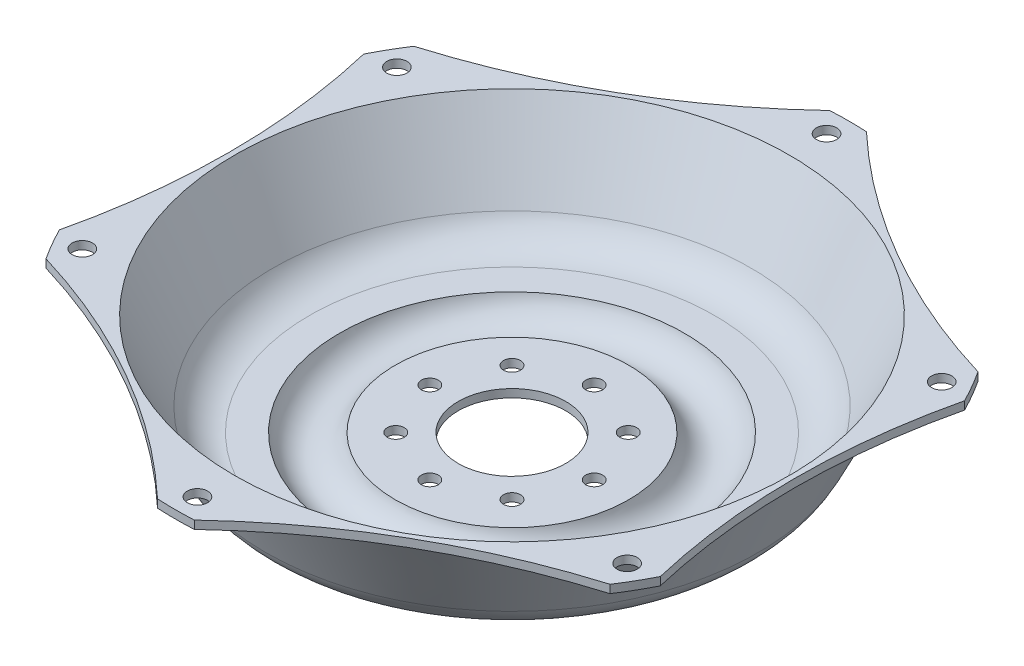
from build123d import *

# Parameters (mm, degrees)
THICKEN1_T1        = 12
CUT_EXTRUDE1_DEPTH = 727.760405867
CIRPATTERN1_COUNT  = 6
CIRPATTERN2_COUNT  = 8


with BuildPart() as body_1:
    # Surface-Revolve1: a surface, the sketch's curves turned about an axis
    with BuildLine(Plane.XY, mode=Mode.PRIVATE) as surface_revolve1_1_path:
        Line((79.5, 0), (172.5, 0))
        ThreePointArc((172.5, 0), (213.5312381, -30.75), (254.5624762, 0))
        Line((254.5624762, 0), (299.5624762, 0))
        ThreePointArc((299.5624762, 0), (331.357632054, 9.117114231), (353.490118977, 33.697731193))
        Line((353.490118977, 33.697731193), (410.214525599, 150))
        Line((410.214525599, 150), (497.75, 150))
    surface_revolve1_1 = Shell.revolve(surface_revolve1_1_path.wire(), 360, Axis((0, 0, 0), (0, 1, 0)))
    add(Solid.thicken(surface_revolve1_1, THICKEN1_T1))

    # Sketch2 → Cut-Extrude1 (cut, through all)
    with BuildSketch(Plane.XZ.offset(-138)):
        with BuildLine():
            ThreePointArc((-416.77522058, 272.12768696), (-208.753886972, 361.809245054), (-27, 497.017165197))
            ThreePointArc((-27, 497.017165197), (-248.752750649, 431.13470232), (-416.77522058, 272.12768696))
        make_face()
        with BuildLine():
            ThreePointArc((0, 480), (-15, 465), (0, 450))
            Line((0, 450), (0, 480))
        make_face()
        with BuildLine():
            Line((0, 480), (0, 450))
            ThreePointArc((0, 450), (10.606601718, 454.393398282), (15, 465))
            ThreePointArc((15, 465), (10.606601718, 475.606601718), (0, 480))
        make_face()
    cut_extrude1 = extrude(amount=-CUT_EXTRUDE1_DEPTH, mode=Mode.SUBTRACT)

    # CirPattern1: Cut-Extrude1 ×6 about axis
    cirpattern1_axis = Axis((0, 0, 0), (0, 1, 0))
    for i in range(1, CIRPATTERN1_COUNT):
        add(cut_extrude1.rotate(cirpattern1_axis, i * 360 / CIRPATTERN1_COUNT), mode=Mode.SUBTRACT)

    # Sketch5 → Ø25.0mm Dowel Hole1 (revolve, cut)
    with BuildSketch(Plane(origin=(0, -12, 121.5), x_dir=(0, 0, -1), z_dir=(1, 0, 0))):
        Polygon((0, 0), (0, 52.510757738), (12.5, 45), (12.5, 0), align=None)
    f_25_0mm_dowel_hole1 = revolve(axis=Axis((0, -18.35, 121.5), (0, 1, 0)), mode=Mode.SUBTRACT)

    # CirPattern2: Ø25.0mm Dowel Hole1 ×8 about axis
    cirpattern2_axis = Axis((0, 0, 0), (0, 1, 0))
    for i in range(1, CIRPATTERN2_COUNT):
        add(f_25_0mm_dowel_hole1.rotate(cirpattern2_axis, i * 360 / CIRPATTERN2_COUNT), mode=Mode.SUBTRACT)


solid = body_1.part
